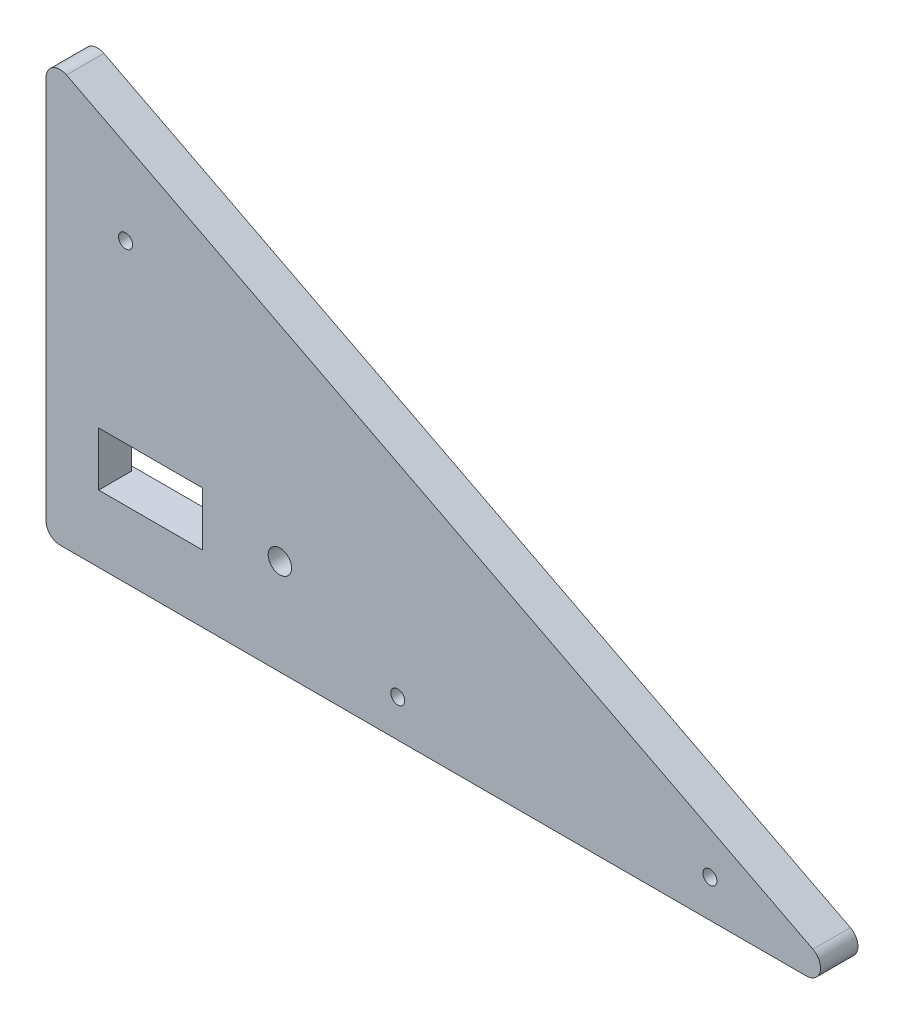
from build123d import *

# Parameters (mm, degrees)
BOSS_EXTRUDE1_DEPTH     = 8
CUT_EXTRUDE6_DEPTH      = 30
CUT_EXTRUDE6_DEPTH_BACK = 30
SKETCH3_R               = 1.5
SKETCH8_W               = 22.2
SKETCH8_H               = 11.5
CUT_EXTRUDE9_DEPTH      = 20
SKETCH11_W              = 5
SKETCH11_H              = 11.5
CUT_EXTRUDE10_DEPTH     = 1
SKETCH8_6_R             = 1.5
CUT_EXTRUDE11_DEPTH     = 10
SKETCH12_R              = 2.5
CUT_EXTRUDE12_DEPTH     = 20


with BuildPart() as part:
    # Sketch1 → Boss-Extrude1 (new body)
    with BuildSketch(Plane.XY):
        with BuildLine():
            Line((-67.152143845, 0), (92.454966604, 0))
            ThreePointArc((92.454966604, 0), (95.370750394, 2.294163695), (93.827010641, 5.667863407))
            Line((93.827010641, 5.667863407), (-65.780099807, 87.751520209))
            ThreePointArc((-65.780099807, 87.751520209), (-68.714812698, 87.64452893), (-70.152143845, 85.083656802))
            Line((-70.152143845, 85.083656802), (-70.152143845, 3))
            ThreePointArc((-70.152143845, 3), (-69.273464189, 0.878679656), (-67.152143845, 0))
        make_face()
    extrude(amount=BOSS_EXTRUDE1_DEPTH)

    # Sketch3 → Cut-Extrude6 (cut, two sides: drawn at the far end of the back side and taken through both)
    with BuildSketch(Plane.XY.offset(-CUT_EXTRUDE6_DEPTH_BACK)):
        with Locations((71.800150685, 8)):
            Circle(SKETCH3_R)
        with Locations((5.050150685, 8)):
            Circle(SKETCH3_R)
    extrude(amount=CUT_EXTRUDE6_DEPTH + CUT_EXTRUDE6_DEPTH_BACK, mode=Mode.SUBTRACT)

    # Sketch8 → Cut-Extrude9 (cut)
    with BuildSketch(Plane.XY.offset(8)):
        with Locations((-47.802143845, 20.074774739)):
            Rectangle(SKETCH8_W, SKETCH8_H)
    extrude(amount=-CUT_EXTRUDE9_DEPTH, mode=Mode.SUBTRACT)

    # Sketch11 → Cut-Extrude10 (cut)
    with BuildSketch(Plane(origin=(0, 0, 0), x_dir=(-1, 0, 0), z_dir=(0, 0, -1))):
        with Locations((61.402143845, 20.074774739)):
            Rectangle(SKETCH11_W, SKETCH11_H)
        with Locations((34.202143845, 20.074774739)):
            Rectangle(SKETCH11_W, SKETCH11_H)
    extrude(amount=-CUT_EXTRUDE10_DEPTH, mode=Mode.SUBTRACT)

    # Sketch8<6> → Cut-Extrude11 (cut)
    with BuildSketch(Plane.XY.offset(8)):
        with Locations((-53.152143845, 63.365389143)):
            Circle(SKETCH8_6_R)
    extrude(amount=-CUT_EXTRUDE11_DEPTH, mode=Mode.SUBTRACT)

    # Sketch12 → Cut-Extrude12 (cut)
    with BuildSketch(Plane.XY.offset(8)):
        with Locations((-20.152143845, 20.5)):
            Circle(SKETCH12_R)
    extrude(amount=-CUT_EXTRUDE12_DEPTH, mode=Mode.SUBTRACT)


solid = part.part
